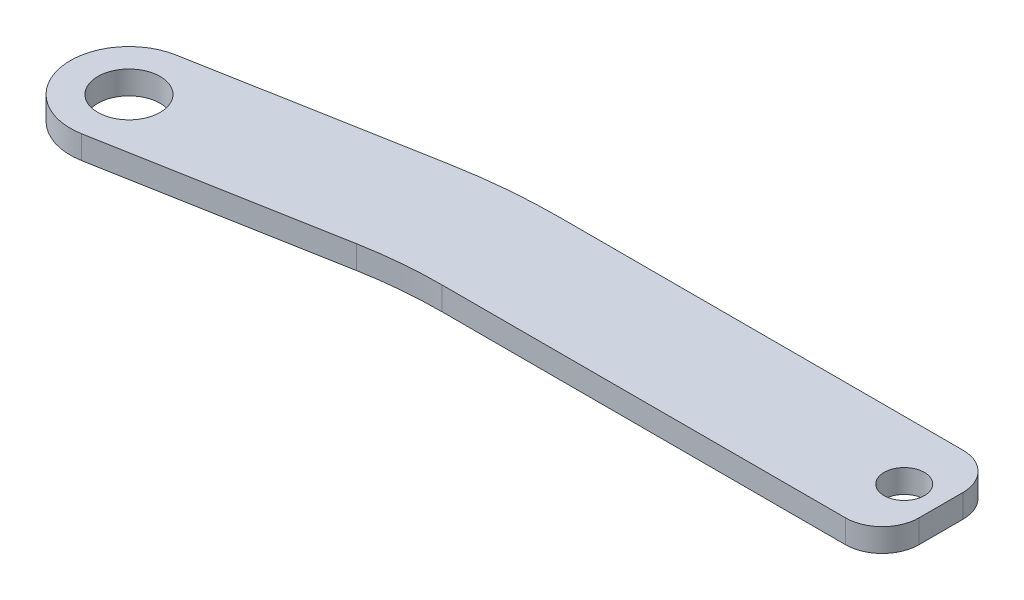
from build123d import *

# Parameters (mm, degrees)
SKETCH1_R           = 4.25
SKETCH1_R_2         = 2.75
BOSS_EXTRUDE1_DEPTH = 3.175


with BuildPart() as part:
    # Sketch1 → Boss-Extrude1 (new body)
    with BuildSketch(Plane(origin=(0, 0, 0), x_dir=(1, 0, 0), z_dir=(0, 1, 0))):
        with BuildLine():
            Line((-1.428652306, 7.871400929), (30.290003092, 13.628308828))
            ThreePointArc((30.290003092, 13.628308828), (37.048664607, 14.543961024), (43.8622, 14.85))
            Line((43.8622, 14.85), (98.8622, 14.85))
            ThreePointArc((98.8622, 14.85), (102.397733906, 13.385533906), (103.8622, 9.85))
            Line((103.8622, 9.85), (103.8622, 3.85))
            ThreePointArc((103.8622, 3.85), (102.397733906, 0.314466094), (98.8622, -1.15))
            Line((98.8622, -1.15), (43.8622, -1.15))
            ThreePointArc((43.8622, -1.15), (38.483093111, -1.391609718), (33.147307705, -2.114493031))
            Line((33.147307705, -2.114493031), (1.428652306, -7.871400929))
            ThreePointArc((1.428652306, -7.871400929), (-7.871400929, -1.428652306), (-1.428652306, 7.871400929))
        make_face()
        with Locations(Location((0, 0, 0), (0, 0, 270))):
            Circle(SKETCH1_R, mode=Mode.SUBTRACT)
        with Locations(Location((98.8622, 6.85, 0), (0, 0, 270))):
            Circle(SKETCH1_R_2, mode=Mode.SUBTRACT)
    extrude(amount=BOSS_EXTRUDE1_DEPTH)


solid = part.part
